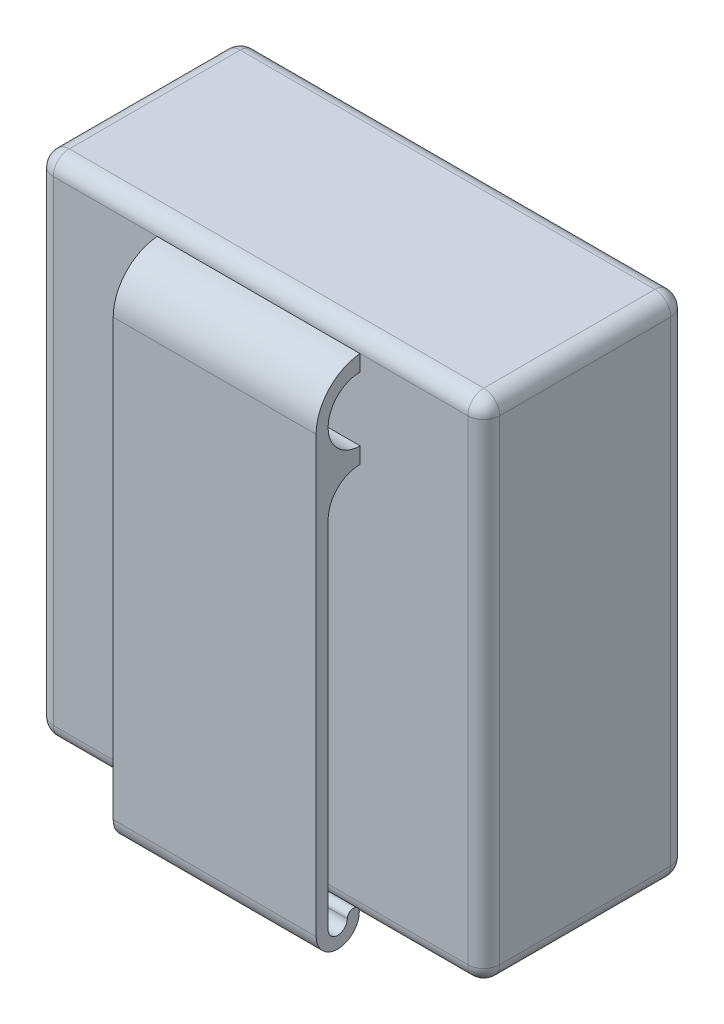
from build123d import *

# Parameters (mm, degrees)
SKETCH1_W           = 55.88
SKETCH1_H           = 63.5
BOSS_EXTRUDE1_DEPTH = 25.4
FILLET1_R           = 2
BOSS_EXTRUDE2_DEPTH = 25.4


with BuildPart() as part:
    # Sketch1 → Boss-Extrude1 (new body)
    with BuildSketch(Plane.XY):
        with Locations((27.94, 31.75)):
            Rectangle(SKETCH1_W, SKETCH1_H)
    extrude(amount=BOSS_EXTRUDE1_DEPTH)

    # Fillet1
    fillet1_edges = [part.edges().sort_by_distance(p)[0] for p in [
        (55.88, 31.75, 25.4),
        (27.94, 63.5, 25.4),
        (0, 31.75, 25.4),
        (27.94, 63.5, 0),
        (55.88, 31.75, 0),
        (27.94, 0, 0),
        (0, 31.75, 0),
        (27.94, 0, 25.4),
        (0, 63.5, 12.7),
        (55.88, 63.5, 12.7),
        (55.88, 0, 12.7),
        (0, 0, 12.7),
    ]]
    fillet(fillet1_edges, radius=FILLET1_R)

    # Sketch3 → Boss-Extrude2 (add)
    with BuildSketch(Plane.ZY.offset(-15)):
        with BuildLine():
            Line((25.4, 61.5), (25.4, 59.5))
            ThreePointArc((25.4, 59.5), (29.4, 55.5), (25.4, 51.5))
            Line((25.4, 51.5), (25.4, 49.5))
            ThreePointArc((25.4, 49.5), (28.228427125, 48.328427125), (29.4, 45.5))
            Line((29.4, 45.5), (29.4, 1.05))
            ThreePointArc((29.4, 1.05), (28.2, -0.15), (27, 1.05))
            ThreePointArc((27, 1.05), (26.25, 1.8), (25.5, 1.05))
            ThreePointArc((25.5, 1.05), (28.2, -1.65), (30.9, 1.05))
            Line((30.9, 1.05), (30.9, 55.5))
            ThreePointArc((30.9, 55.5), (29.316951072, 59.569705149), (25.4, 61.5))
        make_face()
    extrude(amount=-BOSS_EXTRUDE2_DEPTH)


solid = part.part
